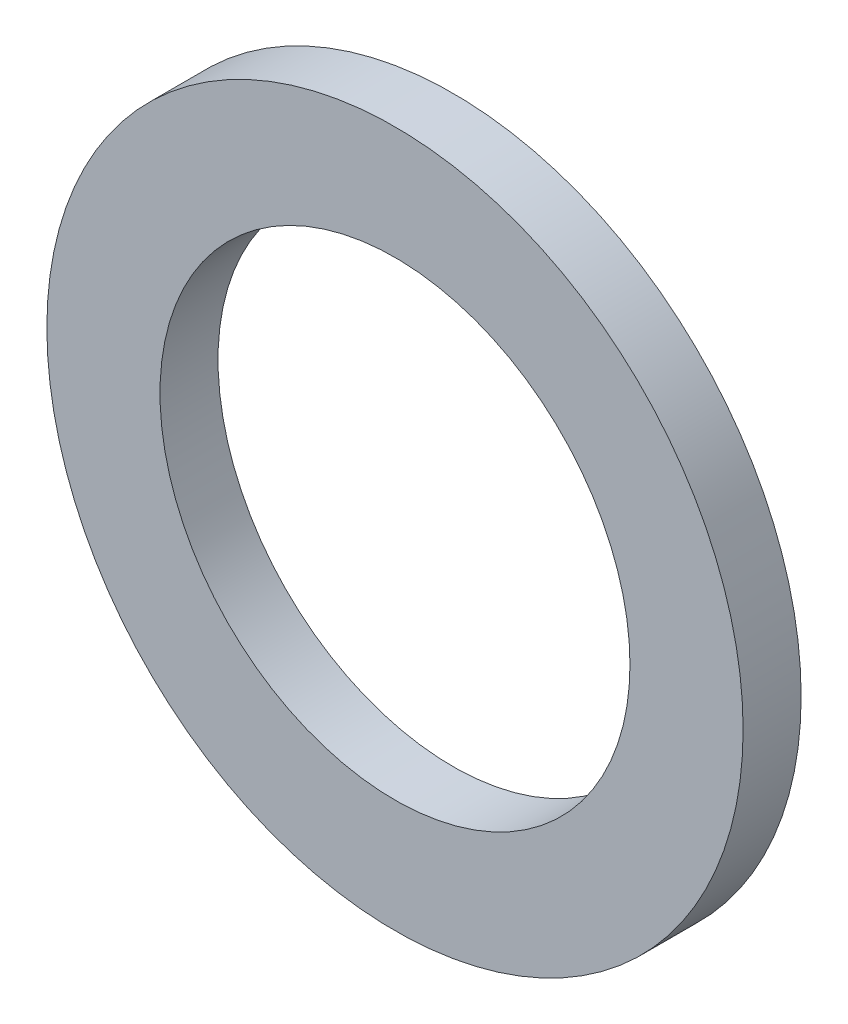
from build123d import *

# Parameters (mm, degrees)
PROFILE_1_R       = 6
PROFILE_1_R_2     = 4.05
THRUST_RING_DEPTH = 1


with BuildPart() as part:
    # Profile_1 → Thrust_ring (new body)
    with BuildSketch(Plane.XY):
        Circle(PROFILE_1_R)
        Circle(PROFILE_1_R_2, mode=Mode.SUBTRACT)
    extrude(amount=THRUST_RING_DEPTH)


solid = part.part
